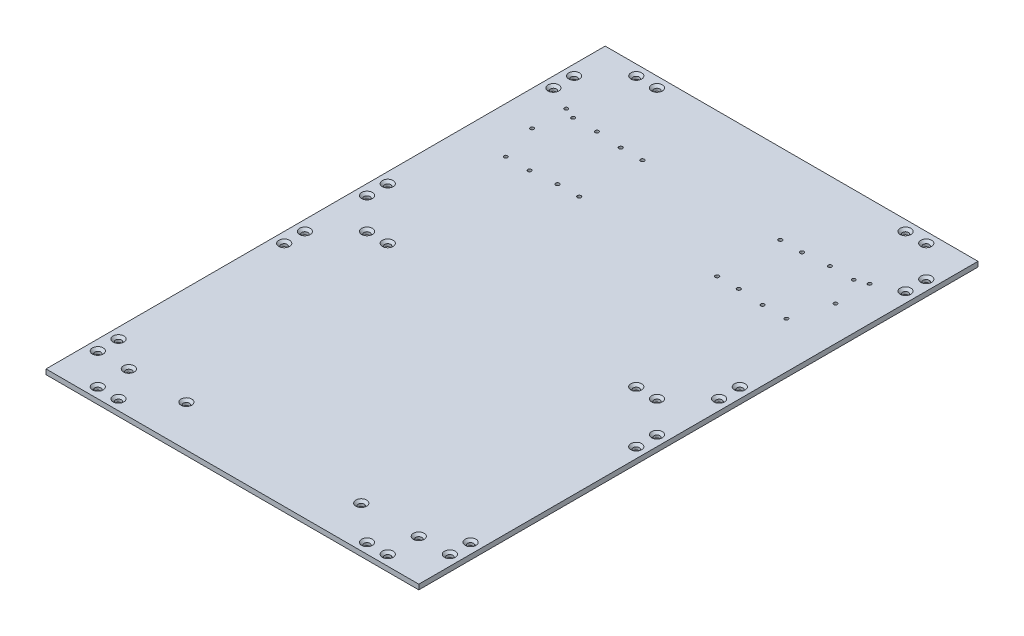
from build123d import *

# Parameters (mm, degrees)
SKETCH1_W                                      = 360
SKETCH1_H                                      = 540
BOSS_EXTRUDE1_DEPTH                            = 4.826
CSK_FOR_M5_FLAT_HEAD_MACHINE_SCREW1_AT_2_COUNT = 2
CSK_FOR_M5_FLAT_HEAD_MACHINE_SCREW1_AT_2_PITCH = 55.5625
CSK_FOR_M5_FLAT_HEAD_MACHINE_SCREW1_AT_3_COUNT = 2
CSK_FOR_M5_FLAT_HEAD_MACHINE_SCREW1_AT_3_PITCH = 224.4375
CSK_FOR_M5_FLAT_HEAD_MACHINE_SCREW1_AT_4_COUNT = 2
CSK_FOR_M5_FLAT_HEAD_MACHINE_SCREW1_AT_4_PITCH = 280
CSK_FOR_M5_FLAT_HEAD_MACHINE_SCREW2_AT_2_COUNT = 2
CSK_FOR_M5_FLAT_HEAD_MACHINE_SCREW2_AT_2_PITCH = 42.426406871
CSK_FOR_M5_FLAT_HEAD_MACHINE_SCREW2_AT_3_COUNT = 2
CSK_FOR_M5_FLAT_HEAD_MACHINE_SCREW2_AT_3_PITCH = 280
CSK_FOR_M5_FLAT_HEAD_MACHINE_SCREW2_AT_4_COUNT = 2
CSK_FOR_M5_FLAT_HEAD_MACHINE_SCREW2_AT_4_PITCH = 311.448230048
CSK_FOR_M5_FLAT_HEAD_MACHINE_SCREW2_AT_5_COUNT = 2
CSK_FOR_M5_FLAT_HEAD_MACHINE_SCREW2_AT_5_PITCH = 231.948270095
CSK_FOR_M5_FLAT_HEAD_MACHINE_SCREW2_AT_6_COUNT = 2
CSK_FOR_M5_FLAT_HEAD_MACHINE_SCREW2_AT_6_PITCH = 260
CSK_FOR_M5_FLAT_HEAD_MACHINE_SCREW2_AT_7_COUNT = 2
CSK_FOR_M5_FLAT_HEAD_MACHINE_SCREW2_AT_7_PITCH = 291.547594742
CSK_FOR_M5_FLAT_HEAD_MACHINE_SCREW2_AT_8_COUNT = 2
CSK_FOR_M5_FLAT_HEAD_MACHINE_SCREW2_AT_8_PITCH = 386.005181312
CSK_FOR_M5_FLAT_HEAD_MACHINE_SCREW2_AT_9_COUNT = 2
CSK_FOR_M5_FLAT_HEAD_MACHINE_SCREW2_AT_9_PITCH = 382.099463491
CSK_FOR_M5_FLAT_HEAD_MACHINE_SCREW2_AT_1_COUNT = 2
CSK_FOR_M5_FLAT_HEAD_MACHINE_SCREW2_AT_1_PITCH = 424.499705536
CSK_FOR_M5_FLAT_HEAD_MACHINE_SCREW2_2_COUNT    = 2
CSK_FOR_M5_FLAT_HEAD_MACHINE_SCREW2_2_PITCH    = 490.917508345
CSK_FOR_M5_FLAT_HEAD_MACHINE_SCREW2_3_COUNT    = 2
CSK_FOR_M5_FLAT_HEAD_MACHINE_SCREW2_3_PITCH    = 520
CSK_FOR_M5_FLAT_HEAD_MACHINE_SCREW2_4_COUNT    = 2
CSK_FOR_M5_FLAT_HEAD_MACHINE_SCREW2_4_PITCH    = 590.592922409
CSK_FOR_M5_FLAT_HEAD_MACHINE_SCREW2_5_COUNT    = 2
CSK_FOR_M5_FLAT_HEAD_MACHINE_SCREW2_5_PITCH    = 579.827560573
CSK_FOR_M5_FLAT_HEAD_MACHINE_SCREW2_6_COUNT    = 2
CSK_FOR_M5_FLAT_HEAD_MACHINE_SCREW2_6_PITCH    = 470.956473573
CSK_FOR_M5_FLAT_HEAD_MACHINE_SCREW2_7_COUNT    = 2
CSK_FOR_M5_FLAT_HEAD_MACHINE_SCREW2_7_PITCH    = 520.38447325
CSK_FOR_M5_FLAT_HEAD_MACHINE_SCREW2_8_COUNT    = 2
CSK_FOR_M5_FLAT_HEAD_MACHINE_SCREW2_8_PITCH    = 581.37767415
CSK_FOR_M5_FLAT_HEAD_MACHINE_SCREW2_9_COUNT    = 2
CSK_FOR_M5_FLAT_HEAD_MACHINE_SCREW2_9_PITCH    = 563.02753041
CSK_FOR_M5_FLAT_HEAD_MACHINE_SCREW2_10_COUNT   = 2
CSK_FOR_M5_FLAT_HEAD_MACHINE_SCREW2_10_PITCH   = 438.406204336
CSK_FOR_M5_FLAT_HEAD_MACHINE_SCREW2_11_COUNT   = 2
CSK_FOR_M5_FLAT_HEAD_MACHINE_SCREW2_11_PITCH   = 367.695526217
CSK_FOR_M5_FLAT_HEAD_MACHINE_SCREW2_12_COUNT   = 2
CSK_FOR_M5_FLAT_HEAD_MACHINE_SCREW2_12_PITCH   = 374.432904537
CSK_FOR_M5_FLAT_HEAD_MACHINE_SCREW2_13_COUNT   = 2
CSK_FOR_M5_FLAT_HEAD_MACHINE_SCREW2_13_PITCH   = 212.132034356
CSK_FOR_M5_FLAT_HEAD_MACHINE_SCREW2_14_COUNT   = 2
CSK_FOR_M5_FLAT_HEAD_MACHINE_SCREW2_14_PITCH   = 260.768096208
CSK_FOR_M5_FLAT_HEAD_MACHINE_SCREW2_15_COUNT   = 2
CSK_FOR_M5_FLAT_HEAD_MACHINE_SCREW2_15_PITCH   = 311.448230048
CSK_FOR_M5_FLAT_HEAD_MACHINE_SCREW2_16_COUNT   = 2
CSK_FOR_M5_FLAT_HEAD_MACHINE_SCREW2_16_PITCH   = 58.309518948
CSK_FOR_M5_FLAT_HEAD_MACHINE_SCREW2_17_COUNT   = 2
CSK_FOR_M5_FLAT_HEAD_MACHINE_SCREW2_17_PITCH   = 20
CSK_FOR_M5_FLAT_HEAD_MACHINE_SCREW2_18_COUNT   = 2
CSK_FOR_M5_FLAT_HEAD_MACHINE_SCREW2_18_PITCH   = 260
CSK_FOR_M5_FLAT_HEAD_MACHINE_SCREW2_19_COUNT   = 2
CSK_FOR_M5_FLAT_HEAD_MACHINE_SCREW2_19_PITCH   = 314.006369362
SKETCH22_R                                     = 1.8
SKETCH22_R_2                                   = 1.7
CUT_EXTRUDE2_DEPTH                             = 9.826000001
SKETCH23_R                                     = 1.7
SKETCH23_R_2                                   = 1.8
CUT_EXTRUDE3_DEPTH                             = 4.826


with BuildPart() as part:
    # Sketch1 → Boss-Extrude1 (new body)
    with BuildSketch(Plane(origin=(0, 0, 0), x_dir=(1, 0, 0), z_dir=(0, 1, 0))):
        with Locations((180, 270)):
            Rectangle(SKETCH1_W, SKETCH1_H)
    extrude(amount=BOSS_EXTRUDE1_DEPTH)

    # Sketch16 → CSK for M5 Flat Head Machine Screw1 (revolve, cut)
    with BuildSketch(Plane(origin=(40, 4.826, -40), x_dir=(0, 0, 1), z_dir=(1, 0, 0))):
        Polygon((0, 0), (0, 4.826), (2.9, 4.826), (2.9, 2.3), (5.2, 0), align=None)
    csk_for_m5_flat_head_machine_screw1 = revolve(axis=Axis((40, 11.176, -40), (0, -1, 0)), mode=Mode.SUBTRACT)

    # CSK for M5 Flat Head Machine Screw1 at 2: CSK for M5 Flat Head Machine Screw1 ×2
    with Locations(*[(i * CSK_FOR_M5_FLAT_HEAD_MACHINE_SCREW1_AT_2_PITCH, 0, 0) for i in range(1, CSK_FOR_M5_FLAT_HEAD_MACHINE_SCREW1_AT_2_COUNT)]):
        add(csk_for_m5_flat_head_machine_screw1, mode=Mode.SUBTRACT)

    # CSK for M5 Flat Head Machine Screw1 at 3: CSK for M5 Flat Head Machine Screw1 ×2
    with Locations(*[(i * CSK_FOR_M5_FLAT_HEAD_MACHINE_SCREW1_AT_3_PITCH, 0, 0) for i in range(1, CSK_FOR_M5_FLAT_HEAD_MACHINE_SCREW1_AT_3_COUNT)]):
        add(csk_for_m5_flat_head_machine_screw1, mode=Mode.SUBTRACT)

    # CSK for M5 Flat Head Machine Screw1 at 4: CSK for M5 Flat Head Machine Screw1 ×2
    with Locations(*[(i * CSK_FOR_M5_FLAT_HEAD_MACHINE_SCREW1_AT_4_PITCH, 0, 0) for i in range(1, CSK_FOR_M5_FLAT_HEAD_MACHINE_SCREW1_AT_4_COUNT)]):
        add(csk_for_m5_flat_head_machine_screw1, mode=Mode.SUBTRACT)

    # Sketch20 → CSK for M5 Flat Head Machine Screw2 (revolve, cut)
    with BuildSketch(Plane(origin=(40, 4.826, -10), x_dir=(0, 0, 1), z_dir=(1, 0, 0))):
        Polygon((0, 0), (0, 4.826), (2.9, 4.826), (2.9, 2.3), (5.2, 0), align=None)
    csk_for_m5_flat_head_machine_screw2 = revolve(axis=Axis((40, 11.176, -10), (0, -1, 0)), mode=Mode.SUBTRACT)

    # CSK for M5 Flat Head Machine Screw2 at 2: CSK for M5 Flat Head Machine Screw2 ×2
    with Locations(*[Vector(-0.7071067811865477, 0, -0.7071067811865475) * (i * CSK_FOR_M5_FLAT_HEAD_MACHINE_SCREW2_AT_2_PITCH) for i in range(1, CSK_FOR_M5_FLAT_HEAD_MACHINE_SCREW2_AT_2_COUNT)]):
        add(csk_for_m5_flat_head_machine_screw2, mode=Mode.SUBTRACT)

    # CSK for M5 Flat Head Machine Screw2 at 3: CSK for M5 Flat Head Machine Screw2 ×2
    with Locations(*[(i * CSK_FOR_M5_FLAT_HEAD_MACHINE_SCREW2_AT_3_PITCH, 0, 0) for i in range(1, CSK_FOR_M5_FLAT_HEAD_MACHINE_SCREW2_AT_3_COUNT)]):
        add(csk_for_m5_flat_head_machine_screw2, mode=Mode.SUBTRACT)

    # CSK for M5 Flat Head Machine Screw2 at 4: CSK for M5 Flat Head Machine Screw2 ×2
    with Locations(*[Vector(0.9953500135553002, 0, -0.09632419486019045) * (i * CSK_FOR_M5_FLAT_HEAD_MACHINE_SCREW2_AT_4_PITCH) for i in range(1, CSK_FOR_M5_FLAT_HEAD_MACHINE_SCREW2_AT_4_COUNT)]):
        add(csk_for_m5_flat_head_machine_screw2, mode=Mode.SUBTRACT)

    # CSK for M5 Flat Head Machine Screw2 at 5: CSK for M5 Flat Head Machine Screw2 ×2
    with Locations(*[Vector(-0.12933918406776806, 0, -0.9916004111862218) * (i * CSK_FOR_M5_FLAT_HEAD_MACHINE_SCREW2_AT_5_PITCH) for i in range(1, CSK_FOR_M5_FLAT_HEAD_MACHINE_SCREW2_AT_5_COUNT)]):
        add(csk_for_m5_flat_head_machine_screw2, mode=Mode.SUBTRACT)

    # CSK for M5 Flat Head Machine Screw2 at 6: CSK for M5 Flat Head Machine Screw2 ×2
    with Locations(*[(0, 0, -i * CSK_FOR_M5_FLAT_HEAD_MACHINE_SCREW2_AT_6_PITCH) for i in range(1, CSK_FOR_M5_FLAT_HEAD_MACHINE_SCREW2_AT_6_COUNT)]):
        add(csk_for_m5_flat_head_machine_screw2, mode=Mode.SUBTRACT)

    # CSK for M5 Flat Head Machine Screw2 at 7: CSK for M5 Flat Head Machine Screw2 ×2
    with Locations(*[Vector(-0.10289915108550529, 0, -0.9946917938265514) * (i * CSK_FOR_M5_FLAT_HEAD_MACHINE_SCREW2_AT_7_PITCH) for i in range(1, CSK_FOR_M5_FLAT_HEAD_MACHINE_SCREW2_AT_7_COUNT)]):
        add(csk_for_m5_flat_head_machine_screw2, mode=Mode.SUBTRACT)

    # CSK for M5 Flat Head Machine Screw2 at 8: CSK for M5 Flat Head Machine Screw2 ×2
    with Locations(*[Vector(0.8030980282338017, 0, -0.5958469241734659) * (i * CSK_FOR_M5_FLAT_HEAD_MACHINE_SCREW2_AT_8_PITCH) for i in range(1, CSK_FOR_M5_FLAT_HEAD_MACHINE_SCREW2_AT_8_COUNT)]):
        add(csk_for_m5_flat_head_machine_screw2, mode=Mode.SUBTRACT)

    # CSK for M5 Flat Head Machine Screw2 at 9: CSK for M5 Flat Head Machine Screw2 ×2
    with Locations(*[Vector(0.7327934916262991, 0, -0.680451099367278) * (i * CSK_FOR_M5_FLAT_HEAD_MACHINE_SCREW2_AT_9_PITCH) for i in range(1, CSK_FOR_M5_FLAT_HEAD_MACHINE_SCREW2_AT_9_COUNT)]):
        add(csk_for_m5_flat_head_machine_screw2, mode=Mode.SUBTRACT)

    # CSK for M5 Flat Head Machine Screw2 at 1: CSK for M5 Flat Head Machine Screw2 ×2
    with Locations(*[Vector(0.7302714135188955, 0, -0.683157128775741) * (i * CSK_FOR_M5_FLAT_HEAD_MACHINE_SCREW2_AT_1_PITCH) for i in range(1, CSK_FOR_M5_FLAT_HEAD_MACHINE_SCREW2_AT_1_COUNT)]):
        add(csk_for_m5_flat_head_machine_screw2, mode=Mode.SUBTRACT)

    # CSK for M5 Flat Head Machine Screw2  2: CSK for M5 Flat Head Machine Screw2 ×2
    with Locations(*[Vector(-0.0611100632795033, 0, -0.9981310335652204) * (i * CSK_FOR_M5_FLAT_HEAD_MACHINE_SCREW2_2_PITCH) for i in range(1, CSK_FOR_M5_FLAT_HEAD_MACHINE_SCREW2_2_COUNT)]):
        add(csk_for_m5_flat_head_machine_screw2, mode=Mode.SUBTRACT)

    # CSK for M5 Flat Head Machine Screw2  3: CSK for M5 Flat Head Machine Screw2 ×2
    with Locations(*[(0, 0, -i * CSK_FOR_M5_FLAT_HEAD_MACHINE_SCREW2_3_PITCH) for i in range(1, CSK_FOR_M5_FLAT_HEAD_MACHINE_SCREW2_3_COUNT)]):
        add(csk_for_m5_flat_head_machine_screw2, mode=Mode.SUBTRACT)

    # CSK for M5 Flat Head Machine Screw2  4: CSK for M5 Flat Head Machine Screw2 ×2
    with Locations(*[Vector(0.4740998230350174, 0, -0.8804710999221753) * (i * CSK_FOR_M5_FLAT_HEAD_MACHINE_SCREW2_4_PITCH) for i in range(1, CSK_FOR_M5_FLAT_HEAD_MACHINE_SCREW2_4_COUNT)]):
        add(csk_for_m5_flat_head_machine_screw2, mode=Mode.SUBTRACT)

    # CSK for M5 Flat Head Machine Screw2  5: CSK for M5 Flat Head Machine Screw2 ×2
    with Locations(*[Vector(0.5346417126044627, 0, -0.8450788360522153) * (i * CSK_FOR_M5_FLAT_HEAD_MACHINE_SCREW2_5_PITCH) for i in range(1, CSK_FOR_M5_FLAT_HEAD_MACHINE_SCREW2_5_COUNT)]):
        add(csk_for_m5_flat_head_machine_screw2, mode=Mode.SUBTRACT)

    # CSK for M5 Flat Head Machine Screw2  6: CSK for M5 Flat Head Machine Screw2 ×2
    with Locations(*[Vector(-0.06370015422533803, 0, -0.9979690828636267) * (i * CSK_FOR_M5_FLAT_HEAD_MACHINE_SCREW2_6_PITCH) for i in range(1, CSK_FOR_M5_FLAT_HEAD_MACHINE_SCREW2_6_COUNT)]):
        add(csk_for_m5_flat_head_machine_screw2, mode=Mode.SUBTRACT)

    # CSK for M5 Flat Head Machine Screw2  7: CSK for M5 Flat Head Machine Screw2 ×2
    with Locations(*[Vector(0.03843312210120418, 0, -0.9992611746313144) * (i * CSK_FOR_M5_FLAT_HEAD_MACHINE_SCREW2_7_PITCH) for i in range(1, CSK_FOR_M5_FLAT_HEAD_MACHINE_SCREW2_7_COUNT)]):
        add(csk_for_m5_flat_head_machine_screw2, mode=Mode.SUBTRACT)

    # CSK for M5 Flat Head Machine Screw2  8: CSK for M5 Flat Head Machine Screw2 ×2
    with Locations(*[Vector(0.4472135954999574, 0, -0.8944271909999162) * (i * CSK_FOR_M5_FLAT_HEAD_MACHINE_SCREW2_8_PITCH) for i in range(1, CSK_FOR_M5_FLAT_HEAD_MACHINE_SCREW2_8_COUNT)]):
        add(csk_for_m5_flat_head_machine_screw2, mode=Mode.SUBTRACT)

    # CSK for M5 Flat Head Machine Screw2  9: CSK for M5 Flat Head Machine Screw2 ×2
    with Locations(*[Vector(0.5505947458271752, 0, -0.8347726791573312) * (i * CSK_FOR_M5_FLAT_HEAD_MACHINE_SCREW2_9_PITCH) for i in range(1, CSK_FOR_M5_FLAT_HEAD_MACHINE_SCREW2_9_COUNT)]):
        add(csk_for_m5_flat_head_machine_screw2, mode=Mode.SUBTRACT)

    # CSK for M5 Flat Head Machine Screw2  10: CSK for M5 Flat Head Machine Screw2 ×2
    with Locations(*[Vector(0.7071067811865475, 0, -0.7071067811865476) * (i * CSK_FOR_M5_FLAT_HEAD_MACHINE_SCREW2_10_PITCH) for i in range(1, CSK_FOR_M5_FLAT_HEAD_MACHINE_SCREW2_10_COUNT)]):
        add(csk_for_m5_flat_head_machine_screw2, mode=Mode.SUBTRACT)

    # CSK for M5 Flat Head Machine Screw2  11: CSK for M5 Flat Head Machine Screw2 ×2
    with Locations(*[Vector(0.7071067811865476, 0, -0.7071067811865476) * (i * CSK_FOR_M5_FLAT_HEAD_MACHINE_SCREW2_11_PITCH) for i in range(1, CSK_FOR_M5_FLAT_HEAD_MACHINE_SCREW2_11_COUNT)]):
        add(csk_for_m5_flat_head_machine_screw2, mode=Mode.SUBTRACT)

    # CSK for M5 Flat Head Machine Screw2  12: CSK for M5 Flat Head Machine Screw2 ×2
    with Locations(*[Vector(0.827918690488332, 0, -0.5608481451695152) * (i * CSK_FOR_M5_FLAT_HEAD_MACHINE_SCREW2_12_PITCH) for i in range(1, CSK_FOR_M5_FLAT_HEAD_MACHINE_SCREW2_12_COUNT)]):
        add(csk_for_m5_flat_head_machine_screw2, mode=Mode.SUBTRACT)

    # CSK for M5 Flat Head Machine Screw2  13: CSK for M5 Flat Head Machine Screw2 ×2
    with Locations(*[Vector(-0.14142135623730953, 0, -0.9899494936611666) * (i * CSK_FOR_M5_FLAT_HEAD_MACHINE_SCREW2_13_PITCH) for i in range(1, CSK_FOR_M5_FLAT_HEAD_MACHINE_SCREW2_13_COUNT)]):
        add(csk_for_m5_flat_head_machine_screw2, mode=Mode.SUBTRACT)

    # CSK for M5 Flat Head Machine Screw2  14: CSK for M5 Flat Head Machine Screw2 ×2
    with Locations(*[Vector(0.07669649888473705, 0, -0.9970544855015816) * (i * CSK_FOR_M5_FLAT_HEAD_MACHINE_SCREW2_14_PITCH) for i in range(1, CSK_FOR_M5_FLAT_HEAD_MACHINE_SCREW2_14_COUNT)]):
        add(csk_for_m5_flat_head_machine_screw2, mode=Mode.SUBTRACT)

    # CSK for M5 Flat Head Machine Screw2  15: CSK for M5 Flat Head Machine Screw2 ×2
    with Locations(*[Vector(-0.09632419486019039, 0, -0.9953500135553002) * (i * CSK_FOR_M5_FLAT_HEAD_MACHINE_SCREW2_15_PITCH) for i in range(1, CSK_FOR_M5_FLAT_HEAD_MACHINE_SCREW2_15_COUNT)]):
        add(csk_for_m5_flat_head_machine_screw2, mode=Mode.SUBTRACT)

    # CSK for M5 Flat Head Machine Screw2  16: CSK for M5 Flat Head Machine Screw2 ×2
    with Locations(*[Vector(-0.5144957554275267, 0, -0.8574929257125442) * (i * CSK_FOR_M5_FLAT_HEAD_MACHINE_SCREW2_16_PITCH) for i in range(1, CSK_FOR_M5_FLAT_HEAD_MACHINE_SCREW2_16_COUNT)]):
        add(csk_for_m5_flat_head_machine_screw2, mode=Mode.SUBTRACT)

    # CSK for M5 Flat Head Machine Screw2  17: CSK for M5 Flat Head Machine Screw2 ×2
    with Locations(*[(i * CSK_FOR_M5_FLAT_HEAD_MACHINE_SCREW2_17_PITCH, 0, 0) for i in range(1, CSK_FOR_M5_FLAT_HEAD_MACHINE_SCREW2_17_COUNT)]):
        add(csk_for_m5_flat_head_machine_screw2, mode=Mode.SUBTRACT)

    # CSK for M5 Flat Head Machine Screw2  18: CSK for M5 Flat Head Machine Screw2 ×2
    with Locations(*[(i * CSK_FOR_M5_FLAT_HEAD_MACHINE_SCREW2_18_PITCH, 0, 0) for i in range(1, CSK_FOR_M5_FLAT_HEAD_MACHINE_SCREW2_18_COUNT)]):
        add(csk_for_m5_flat_head_machine_screw2, mode=Mode.SUBTRACT)

    # CSK for M5 Flat Head Machine Screw2  19: CSK for M5 Flat Head Machine Screw2 ×2
    with Locations(*[Vector(0.9872411207126471, 0, -0.1592324388246205) * (i * CSK_FOR_M5_FLAT_HEAD_MACHINE_SCREW2_19_PITCH) for i in range(1, CSK_FOR_M5_FLAT_HEAD_MACHINE_SCREW2_19_COUNT)]):
        add(csk_for_m5_flat_head_machine_screw2, mode=Mode.SUBTRACT)

    # Sketch22 → Cut-Extrude2 (cut)
    with BuildSketch(Plane(origin=(0, 9.826000001, 0), x_dir=(1, 0, 0), z_dir=(0, 1, 0))):
        with Locations(Location((246.6, 462.5, 0), (0, 0, 270))):
            Circle(SKETCH22_R)
        with Locations(Location((267.5, 462.5, 0), (0, 0, 270))):
            Circle(SKETCH22_R)
        with Locations(Location((267.5, 401.5, 0), (0, 0, 270))):
            Circle(SKETCH22_R)
        with Locations(Location((292.5, 399.499999999, 0), (0, 0, 270))):
            Circle(SKETCH22_R_2)
        with Locations(Location((246.6, 401.5, 0), (0, 0, 270))):
            Circle(SKETCH22_R)
        with Locations(Location((292.5, 464.499999999, 0), (0, 0, 270))):
            Circle(SKETCH22_R_2)
        with Locations(Location((315.5, 464.499999999, 0), (0, 0, 270))):
            Circle(SKETCH22_R_2)
        with Locations(Location((315.5, 399.499999999, 0), (0, 0, 270))):
            Circle(SKETCH22_R_2)
        with Locations(Location((326.5, 435.837822173, 0), (0, 0, 270))):
            Circle(SKETCH22_R_2)
        with Locations(Location((326.5, 468.837822173, 0), (0, 0, 270))):
            Circle(SKETCH22_R_2)
    extrude(amount=-CUT_EXTRUDE2_DEPTH, mode=Mode.SUBTRACT)

    # Sketch23 → Cut-Extrude3 (cut)
    with BuildSketch(Plane(origin=(0, 4.826, 0), x_dir=(1, 0, 0), z_dir=(0, 1, 0))):
        with Locations(Location((67.5, 464.499999998, 0), (0, 0, 270))):
            Circle(SKETCH23_R)
        with Locations(Location((92.5, 462.5, 0), (0, 0, 270))):
            Circle(SKETCH23_R_2)
        with Locations(Location((113.4, 462.5, 0), (0, 0, 270))):
            Circle(SKETCH23_R_2)
        with Locations(Location((92.5, 401.5, 0), (0, 0, 270))):
            Circle(SKETCH23_R_2)
        with Locations(Location((113.4, 401.5, 0), (0, 0, 270))):
            Circle(SKETCH23_R_2)
        with Locations(Location((67.5, 399.499999998, 0), (0, 0, 270))):
            Circle(SKETCH23_R)
        with Locations(Location((44.5, 399.499999998, 0), (0, 0, 270))):
            Circle(SKETCH23_R)
        with Locations(Location((33.5, 468.837822173, 0), (0, 0, 270))):
            Circle(SKETCH23_R)
        with Locations(Location((33.5, 435.837822173, 0), (0, 0, 270))):
            Circle(SKETCH23_R)
        with Locations(Location((44.5, 464.499999998, 0), (0, 0, 270))):
            Circle(SKETCH23_R)
    extrude(amount=-CUT_EXTRUDE3_DEPTH, mode=Mode.SUBTRACT)


solid = part.part
